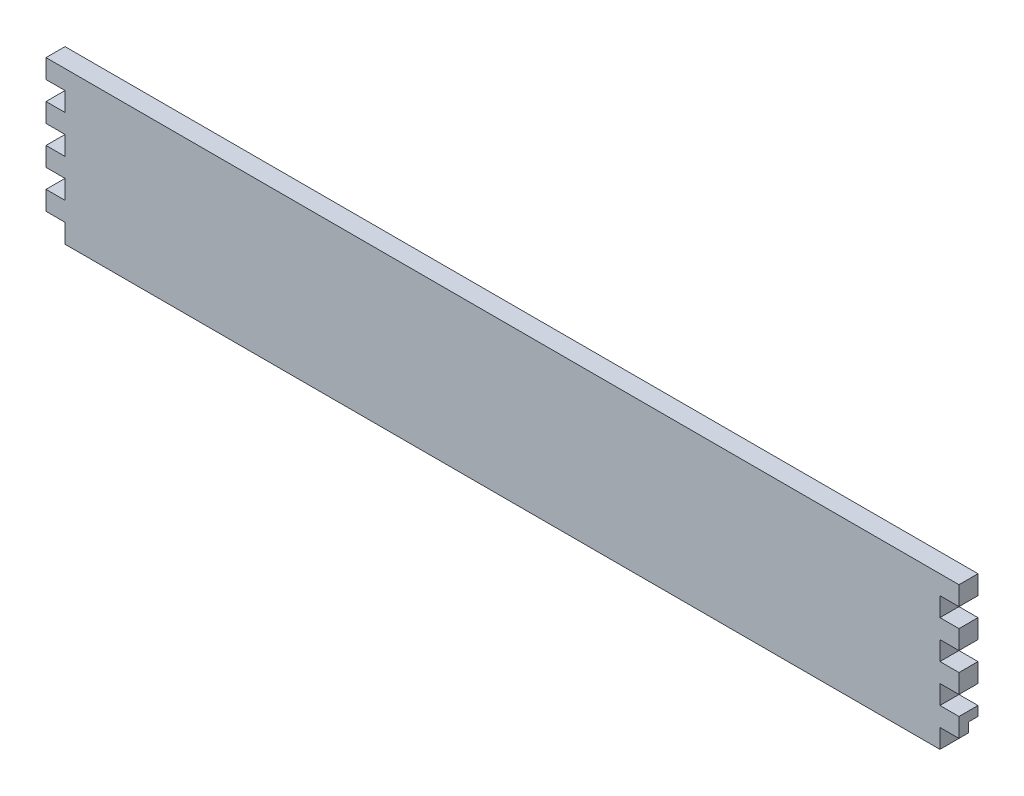
from build123d import *

# Parameters (mm, degrees)
BOSS_EXTRUDE1_DEPTH = 12.7
SKETCH2_W           = 637.164894533
SKETCH2_H           = 6.35
CUT_EXTRUDE1_DEPTH  = 6.35


with BuildPart() as part:
    # Sketch1 → Boss-Extrude1 (new body)
    with BuildSketch(Plane.XY):
        Polygon((0, 25.4), (0, 12.7), (12.7, 12.7), (12.7, 0), (596.9, 0), (596.9, 12.7), (609.6, 12.7), (609.6, 25.4), (596.9, 25.4), (596.9, 38.1), (609.6, 38.1), (609.6, 50.8), (596.9, 50.8), (596.9, 63.5), (609.6, 63.5), (609.6, 76.2), (596.9, 76.2), (596.9, 88.9), (609.6, 88.9), (609.6, 101.6), (0, 101.6), (0, 88.9), (12.7, 88.9), (12.7, 76.2), (0, 76.2), (0, 63.5), (12.7, 63.5), (12.7, 50.8), (0, 50.8), (0, 38.1), (12.7, 38.1), (12.7, 25.4), align=None)
    extrude(amount=BOSS_EXTRUDE1_DEPTH)

    # Sketch2 → Cut-Extrude1 (cut)
    with BuildSketch(Plane.XY):
        with Locations((307.699845939, 15.875)):
            Rectangle(SKETCH2_W, SKETCH2_H)
    extrude(amount=CUT_EXTRUDE1_DEPTH, mode=Mode.SUBTRACT)


solid = part.part
